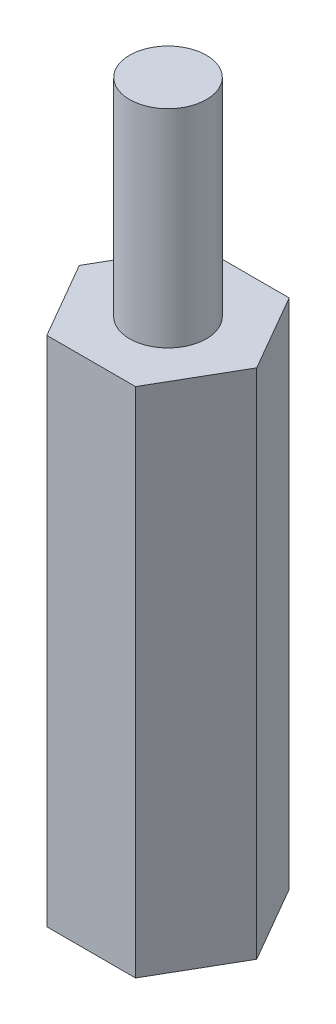
from build123d import *

# Parameters (mm, degrees)
BOSS_EXTRUDE1_DEPTH = 20
SKETCH5_R           = 1.5
BOSS_EXTRUDE2_DEPTH = 8.091605471
SKETCH6_R           = 1.5
CUT_EXTRUDE1_DEPTH  = 4


with BuildPart() as part:
    # Sketch3 → Boss-Extrude1 (new body)
    with BuildSketch(Plane(origin=(0, 0, 0), x_dir=(1, 0, 0), z_dir=(0, 1, 0))):
        Polygon((-3.464101615, 0), (-1.732050808, -3), (1.732050808, -3), (3.464101615, 0), (1.732050808, 3), (-1.732050808, 3), align=None)
    extrude(amount=BOSS_EXTRUDE1_DEPTH)

    # Sketch5 → Boss-Extrude2 (add)
    with BuildSketch(Plane(origin=(0, 20, 0), x_dir=(1, 0, 0), z_dir=(0, 1, 0))):
        with Locations(Location((0, 0, 0), (0, 0, 270))):
            Circle(SKETCH5_R)
    extrude(amount=BOSS_EXTRUDE2_DEPTH)

    # Sketch6 → Cut-Extrude1 (cut)
    with BuildSketch(Plane.XZ):
        with Locations(Location((0, 0, 0), (0, 0, 90))):
            Circle(SKETCH6_R)
    extrude(amount=-CUT_EXTRUDE1_DEPTH, mode=Mode.SUBTRACT)


solid = part.part
